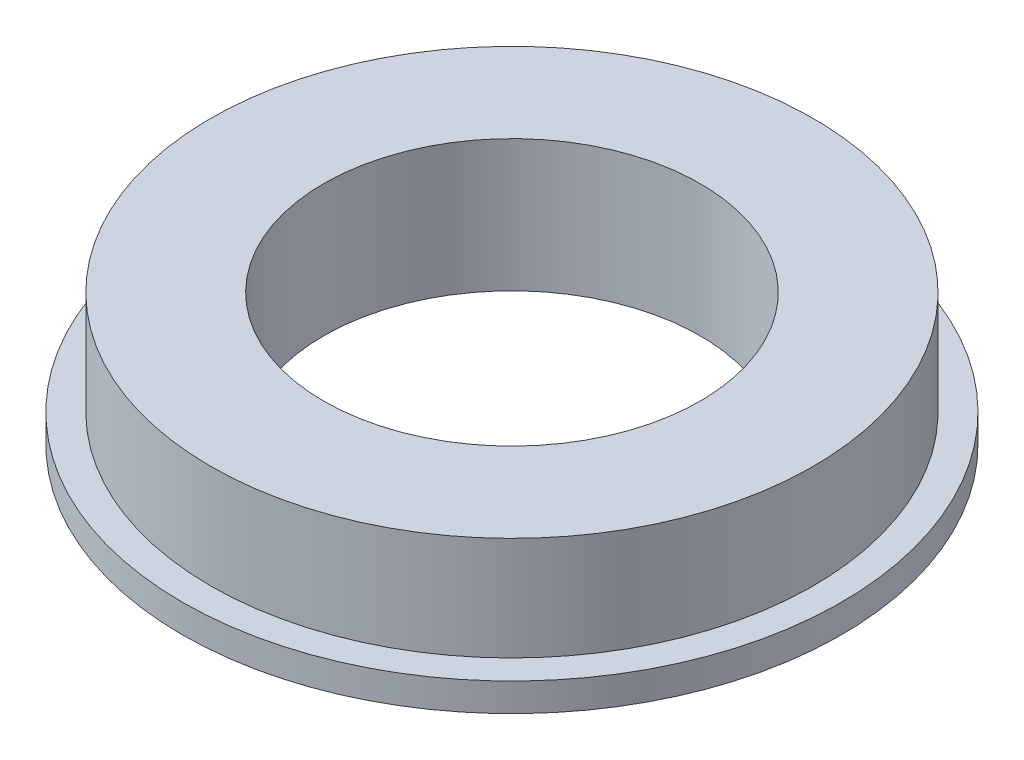
from build123d import *

# Parameters (mm, degrees)
SKETCH_1_R      = 17.5
SKETCH_1_R_2    = 10
EXTRUDE_1_DEPTH = 1.5
SKETCH_2_R      = 16
SKETCH_2_R_2    = 10
EXTRUDE_2_DEPTH = 5.5


with BuildPart() as part:
    # 草图1 → 凸台-拉伸1 (new body)
    with BuildSketch(Plane(origin=(0, 0, 0), x_dir=(1, 0, 0), z_dir=(0, 1, 0))):
        with Locations(Location((0, 0, 0), (0, 0, 270))):
            Circle(SKETCH_1_R)
        with Locations(Location((0, 0, 0), (0, 0, 270))):
            Circle(SKETCH_1_R_2, mode=Mode.SUBTRACT)
    extrude(amount=EXTRUDE_1_DEPTH)

    # 草图2 → 凸台-拉伸2 (add)
    with BuildSketch(Plane(origin=(0, 1.5, 0), x_dir=(1, 0, 0), z_dir=(0, 1, 0))):
        with Locations(Location((0, 0, 0), (0, 0, 270))):
            Circle(SKETCH_2_R)
        with Locations(Location((0, 0, 0), (0, 0, 270))):
            Circle(SKETCH_2_R_2, mode=Mode.SUBTRACT)
    extrude(amount=EXTRUDE_2_DEPTH)


solid = part.part
